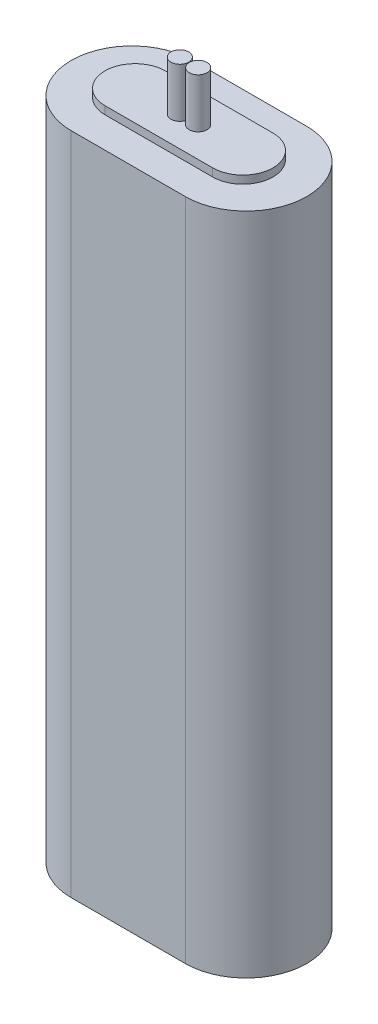
from build123d import *

# Parameters (mm, degrees)
BOSS_EXTRU_1_DEPTH = 67.2
BOSS_EXTRU_2_DEPTH = 1.6
ESQUISSE3_R        = 1.8
BOSS_EXTRU_3_DEPTH = 10


with BuildPart() as part:
    # Esquisse1 → Boss.-Extru.1 (new, symmetric)
    with BuildSketch(Plane(origin=(0, 0, 0), x_dir=(1, 0, 0), z_dir=(0, 1, 0))):
        with BuildLine():
            Line((-11.55, 12.3), (11.55, 12.3))
            ThreePointArc((11.55, 12.3), (23.85, 0), (11.55, -12.3))
            Line((11.55, -12.3), (-11.55, -12.3))
            ThreePointArc((-11.55, -12.3), (-23.85, 0), (-11.55, 12.3))
        make_face()
    extrude(amount=BOSS_EXTRU_1_DEPTH, both=True)

    # Esquisse2 → Boss.-Extru.2 (add)
    with BuildSketch(Plane(origin=(0, 67.2, 0), x_dir=(1, 0, 0), z_dir=(0, 1, 0))):
        with BuildLine():
            Line((-10.9, 6.1), (10.9, 6.1))
            ThreePointArc((10.9, 6.1), (17, 0), (10.9, -6.1))
            Line((10.9, -6.1), (-10.9, -6.1))
            ThreePointArc((-10.9, -6.1), (-17, 0), (-10.9, 6.1))
        make_face()
    extrude(amount=BOSS_EXTRU_2_DEPTH)

    # Esquisse3 → Boss.-Extru.3 (add)
    with BuildSketch(Plane(origin=(0, 68.8, 0), x_dir=(1, 0, 0), z_dir=(0, 1, 0))):
        with Locations(Location((-1.85, 0, 0), (0, 0, 270))):
            Circle(ESQUISSE3_R)
        with Locations(Location((1.85, 0, 0), (0, 0, 90))):
            Circle(ESQUISSE3_R)
    extrude(amount=BOSS_EXTRU_3_DEPTH)


solid = part.part
